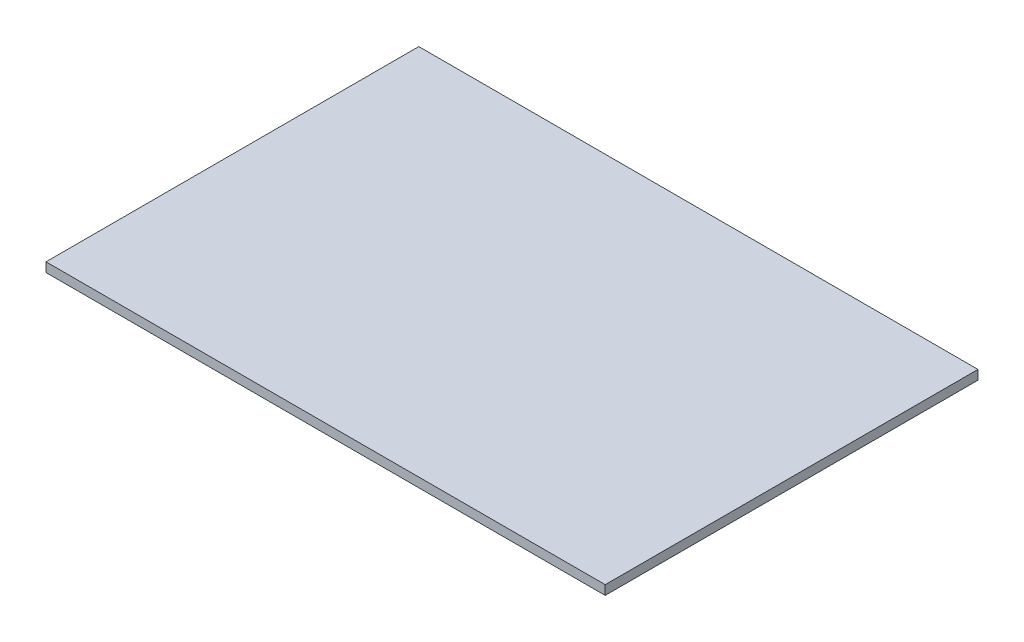
from build123d import *

# Parameters (mm, degrees)
ESQUISSE1_W      = 3000
ESQUISSE1_H      = 2000
EXTRUSION1_DEPTH = 50


with BuildPart() as part:
    # Esquisse1 → Extrusion1 (new body)
    with BuildSketch(Plane(origin=(0, 0, 0), x_dir=(1, 0, 0), z_dir=(0, 1, 0))):
        Rectangle(ESQUISSE1_W, ESQUISSE1_H)
    extrude(amount=EXTRUSION1_DEPTH)


solid = part.part
